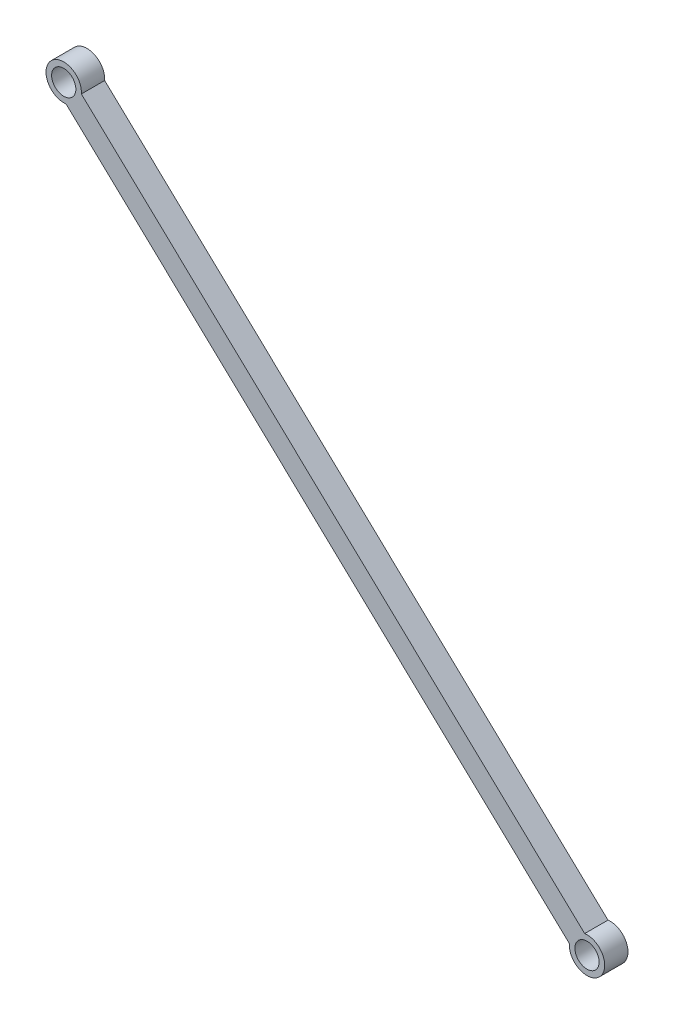
from build123d import *

# Parameters (mm, degrees)
SKETCH1_R           = 0.65
BOSS_EXTRUDE1_DEPTH = 1.25


with BuildPart() as part:
    # Sketch1 → Boss-Extrude1 (new body)
    with BuildSketch(Plane.XY):
        with BuildLine():
            Line((-7.099118434, -3.169431628), (-34.110478454, 22.345705899))
            ThreePointArc((-34.110478454, 22.345705899), (-34.924507934, 23.940006182), (-33.286454964, 23.218050606))
            Line((-33.286454964, 23.218050606), (-6.275094943, -2.297086921))
            ThreePointArc((-6.275094943, -2.297086921), (-5.461065464, -3.891387204), (-7.099118434, -3.169431628))
        make_face()
        with Locations((-6.15167169, -3.239035274)):
            Circle(SKETCH1_R, mode=Mode.SUBTRACT)
        with Locations((-34.233901708, 23.287654252)):
            Circle(SKETCH1_R, mode=Mode.SUBTRACT)
    extrude(amount=BOSS_EXTRUDE1_DEPTH)


solid = part.part
